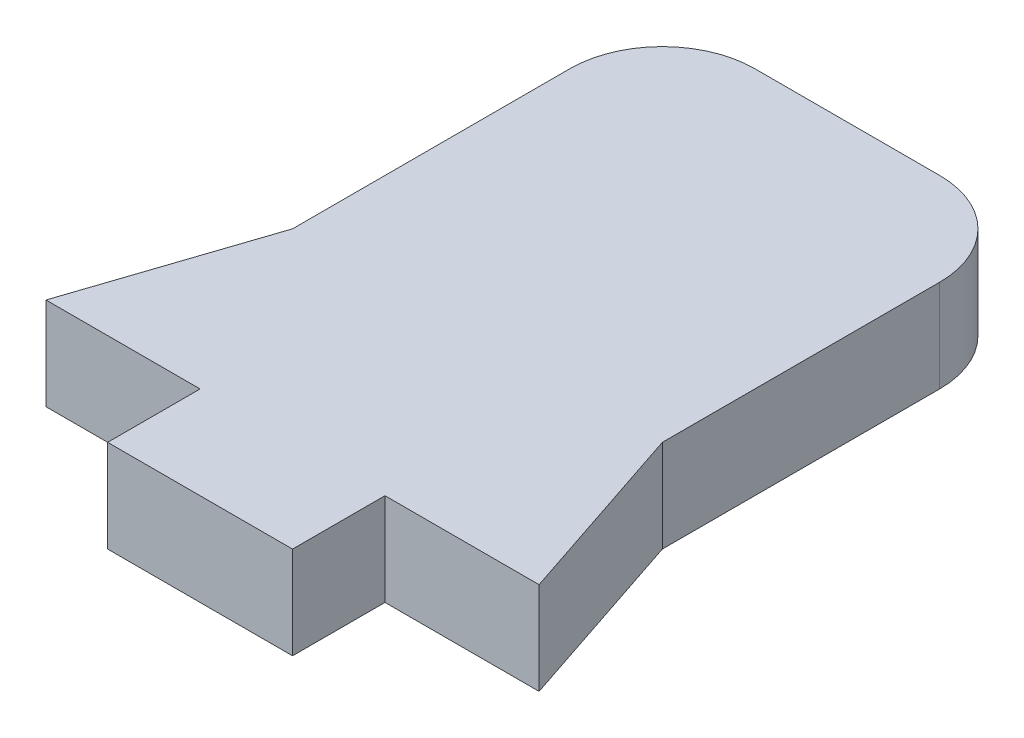
from build123d import *

# Parameters (mm, degrees)
BOSS_EXTRUDE4_DEPTH = 1.5
SKETCH8_W           = 6
SKETCH8_H           = 3
BOSS_EXTRUDE5_DEPTH = 1.5
BOSS_EXTRUDE6_DEPTH = 1.5


with BuildPart() as part:
    # Sketch6 → Boss-Extrude4 (new, symmetric)
    with BuildSketch(Plane(origin=(0, 0, 0), x_dir=(1, 0, 0), z_dir=(0, 1, 0))):
        with BuildLine():
            Line((-3, 10.5), (3, 10.5))
            ThreePointArc((3, 10.5), (5.121320344, 9.621320344), (6, 7.5))
            Line((6, 7.5), (6, -7.5))
            Line((6, -7.5), (-6, -7.5))
            Line((-6, -7.5), (-6, 7.5))
            ThreePointArc((-6, 7.5), (-5.121320344, 9.621320344), (-3, 10.5))
        make_face()
    extrude(amount=BOSS_EXTRUDE4_DEPTH, both=True)

    # Sketch8 → Boss-Extrude5 (add, symmetric)
    with BuildSketch(Plane(origin=(0, 0, 0), x_dir=(1, 0, 0), z_dir=(0, 1, 0))):
        with Locations((0, -9)):
            Rectangle(SKETCH8_W, SKETCH8_H)
    extrude(amount=BOSS_EXTRUDE5_DEPTH, both=True)

    # Sketch9 → Boss-Extrude6 (add, symmetric)
    with BuildSketch(Plane(origin=(0, 0, 0), x_dir=(1, 0, 0), z_dir=(0, 1, 0))):
        Polygon((-6, -1.5), (-8, -7.5), (-6, -7.5), align=None)
        Polygon((6, -1.5), (6, -7.5), (8, -7.5), align=None)
    extrude(amount=BOSS_EXTRUDE6_DEPTH, both=True)


solid = part.part
